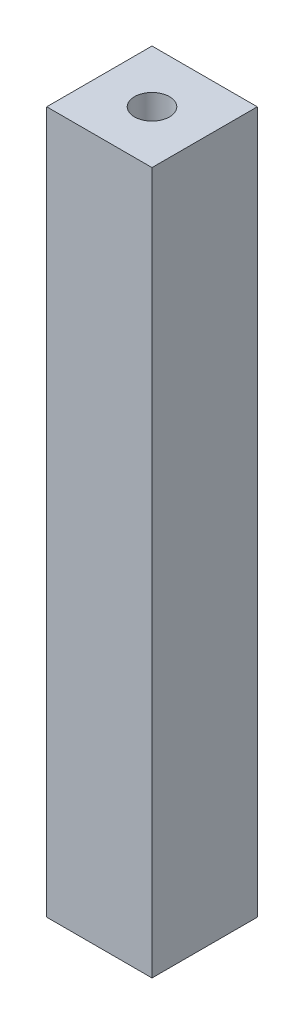
from build123d import *

# Parameters (mm, degrees)
SKETCH1_W           = 15
SKETCH1_H           = 15
SKETCH1_R           = 2.5
BOSS_EXTRUDE1_DEPTH = 100


with BuildPart() as part:
    # Sketch1 → Boss-Extrude1 (new body)
    with BuildSketch(Plane(origin=(0, 0, 0), x_dir=(1, 0, 0), z_dir=(0, 1, 0))):
        Rectangle(SKETCH1_W, SKETCH1_H)
        with Locations(Location((0, 0, 0), (0, 0, 270))):
            Circle(SKETCH1_R, mode=Mode.SUBTRACT)
    extrude(amount=BOSS_EXTRUDE1_DEPTH)


solid = part.part
